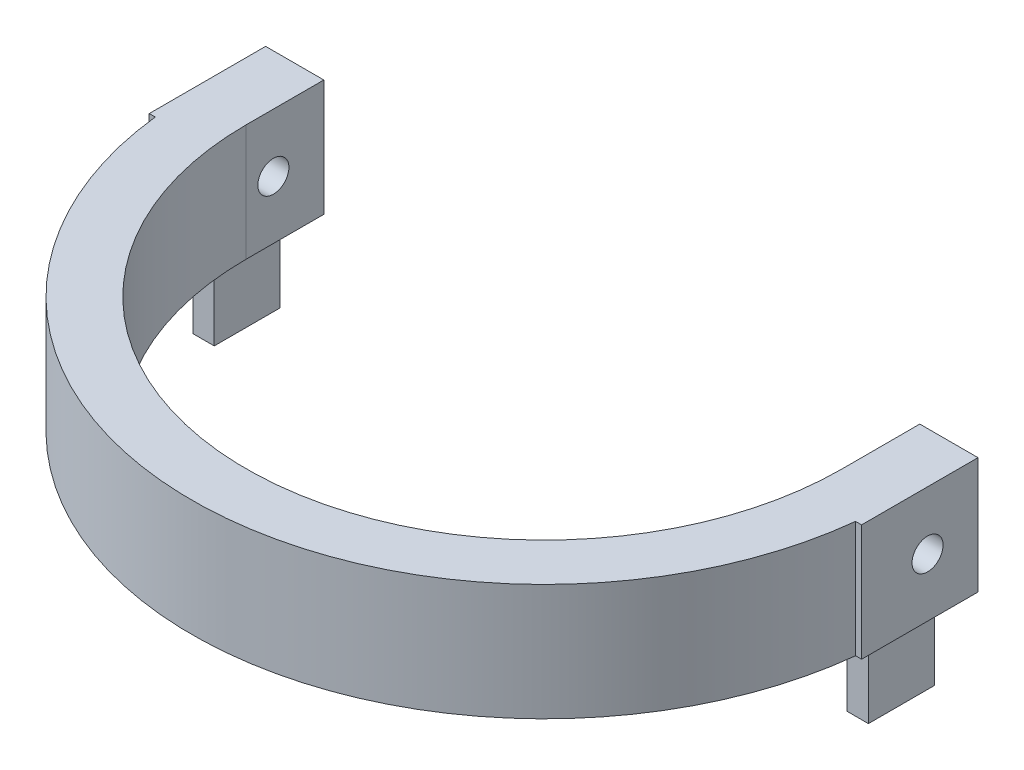
from build123d import *

# Parameters (mm, degrees)
BOSS_EXTRUDE1_DEPTH      = 60
SKETCH25_W               = 5.5
SKETCH25_H               = 17
BOSS_EXTRUDE3_DEPTH      = 20
FILLET1_R                = 2.3
CUT_EXTRUDE19_DEPTH      = 165.638713704
CUT_EXTRUDE19_DEPTH_BACK = 165.638713704
SKETCH30_W               = 183.61
SKETCH30_H               = 30
SKETCH31_R               = 4
CUT_EXTRUDE20_DEPTH      = 220.90493429


with BuildPart() as part:
    # Sketch1 → Boss-Extrude1 (new body)
    with BuildSketch(Plane(origin=(0, 0, 0), x_dir=(1, 0, 0), z_dir=(0, 1, 0))):
        with BuildLine():
            Line((91.805, -10), (90.252689849, -10))
            ThreePointArc((90.252689849, -10), (0, -90.805), (-90.252689849, -10))
            Line((-90.252689849, -10), (-91.805, -10))
            Line((-91.805, -10), (-91.805, 20))
            Line((-91.805, 20), (-76.805, 20))
            Line((-76.805, 20), (-76.805, 0))
            ThreePointArc((-76.805, 0), (0, -76.805), (76.805, 0))
            Line((76.805, 0), (76.805, 20))
            Line((76.805, 20), (91.805, 20))
            Line((91.805, 20), (91.805, -10))
        make_face()
    extrude(amount=-BOSS_EXTRUDE1_DEPTH)

    # Sketch25 → Boss-Extrude3 (add)
    with BuildSketch(Plane(origin=(0, -60, 0), x_dir=(-1, 0, 0), z_dir=(0, -1, 0))):
        with Locations((84.305, 5)):
            Rectangle(SKETCH25_W, SKETCH25_H)
        with Locations((-84.305, 5)):
            Rectangle(SKETCH25_W, SKETCH25_H)
    extrude(amount=BOSS_EXTRUDE3_DEPTH)

    # Fillet1
    fillet1_edges = [part.edges().sort_by_distance(p)[0] for p in [
        (84.305, -60, 3.5),
        (81.555, -60, -5),
        (87.055, -60, -5),
        (84.305, -60, -13.5),
        (-84.305, -60, 3.5),
        (-87.055, -60, -5),
        (-81.555, -60, -5),
        (-84.305, -60, -13.5),
    ]]
    fillet(fillet1_edges, radius=FILLET1_R)

    # Sketch30 → Cut-Extrude19 (cut, two sides: drawn at the far end of the back side and taken through both)
    with BuildSketch(Plane(origin=(0, 0, -20), x_dir=(-1, 0, 0), z_dir=(0, 0, -1)).offset(-CUT_EXTRUDE19_DEPTH_BACK)):
        with Locations((0, -15)):
            Rectangle(SKETCH30_W, SKETCH30_H)
    extrude(amount=CUT_EXTRUDE19_DEPTH + CUT_EXTRUDE19_DEPTH_BACK, mode=Mode.SUBTRACT)

    # Sketch31 → Cut-Extrude20 (cut, through all)
    with BuildSketch(Plane(origin=(91.805, 0, 0), x_dir=(0, 0, -1), z_dir=(1, 0, 0))):
        with Locations((7, -45)):
            Circle(SKETCH31_R)
    extrude(amount=-CUT_EXTRUDE20_DEPTH, mode=Mode.SUBTRACT)


solid = part.part
